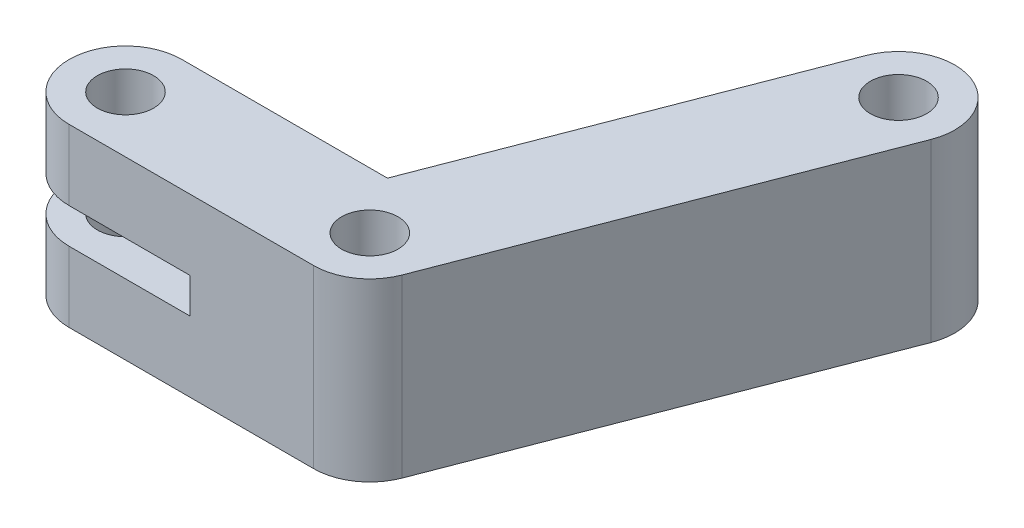
from build123d import *

# Parameters (mm, degrees)
SKETCH1_R           = 4
BOSS_EXTRUDE1_DEPTH = 12.5
CUT_EXTRUDE1_REACH  = 97.583
SKETCH2_W           = 25.15
SKETCH2_H           = 5


with BuildPart() as part:
    # Sketch1 → Boss-Extrude1 (new, symmetric)
    with BuildSketch(Plane(origin=(0, 0, 0), x_dir=(1, 0, 0), z_dir=(0, 1, 0))):
        with BuildLine():
            Line((0, 8), (29.228297239, 8))
            Line((29.228297239, 8), (48.144548452, 57.11524489))
            ThreePointArc((48.144548452, 57.11524489), (58.48524489, 61.705451548), (63.075451548, 51.36475511))
            Line((63.075451548, 51.36475511), (42.185451548, -2.87524489))
            ThreePointArc((42.185451548, -2.87524489), (39.247584393, -6.595527239), (34.72, -8))
            Line((34.72, -8), (0, -8))
            ThreePointArc((0, -8), (-8, 0), (0, 8))
        make_face()
        with Locations(Location((0, 0, 0), (0, 0, 270))):
            Circle(SKETCH1_R, mode=Mode.SUBTRACT)
        with Locations(Location((55.61, 54.24, 0), (0, 0, 270))):
            Circle(SKETCH1_R, mode=Mode.SUBTRACT)
        with Locations(Location((34.72, 0, 0), (0, 0, 270))):
            Circle(SKETCH1_R, mode=Mode.SUBTRACT)
    extrude(amount=BOSS_EXTRUDE1_DEPTH, both=True)

    # Sketch2 → Cut-Extrude1 (cut, up to next)
    with BuildSketch(Plane.XY.offset(8), mode=Mode.PRIVATE) as cut_extrude1_sk1:
        with Locations((4.575, 0)):
            Rectangle(SKETCH2_W, SKETCH2_H)
    cut_extrude1_tool1 = extrude(cut_extrude1_sk1.sketch, amount=-CUT_EXTRUDE1_REACH, mode=Mode.PRIVATE) & part.part
    add(cut_extrude1_tool1.solids().sort_by_distance((4.575, 0, 8))[0], mode=Mode.SUBTRACT)


solid = part.part
